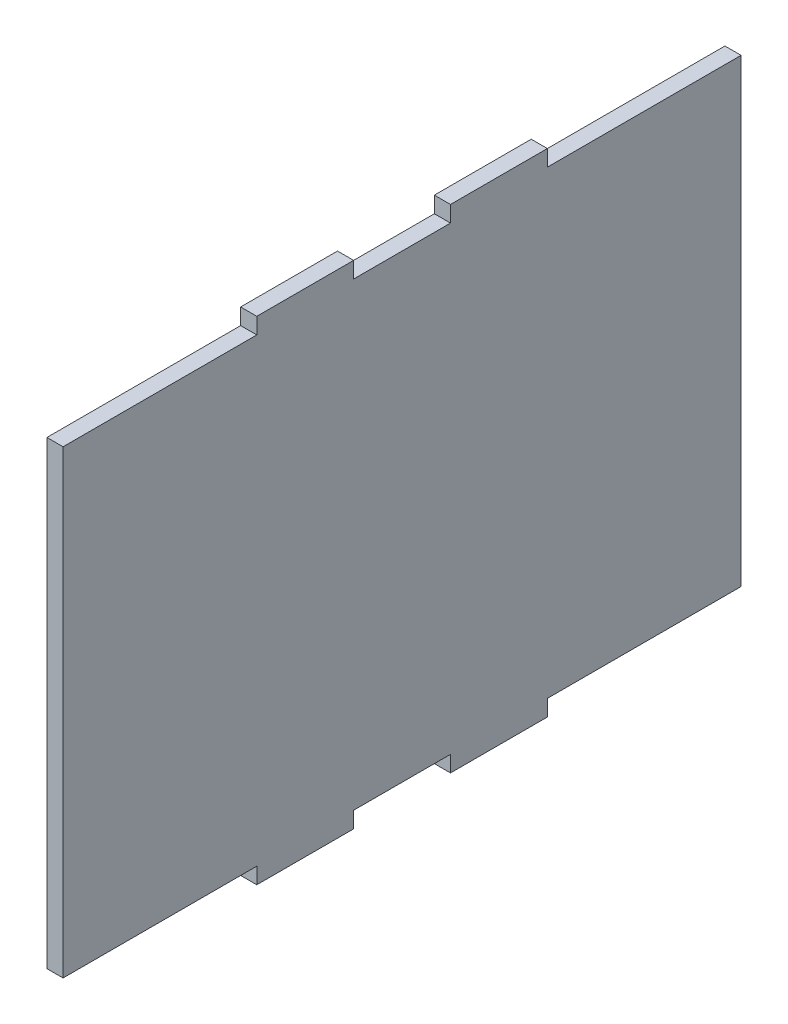
from build123d import *

# Parameters (mm, degrees)
BOSS_EXTRUDE1_DEPTH = 10


with BuildPart() as part:
    # Sketch1 → Boss-Extrude1 (new body)
    with BuildSketch(Plane(origin=(0, 0, 0), x_dir=(0, 0, -1), z_dir=(1, 0, 0))):
        Polygon((-328.894741549, 211.221531582), (-208.894741549, 211.221531582), (-208.894741549, 221.221531582), (-148.894741549, 221.221531582), (-148.894741549, 211.221531582), (-88.894741549, 211.221531582), (-88.894741549, 221.221531582), (-28.894741549, 221.221531582), (-28.894741549, 211.221531582), (91.105258451, 211.221531582), (91.105258451, -73.778468418), (-28.894741549, -73.778468418), (-28.894741549, -83.778468418), (-88.894741549, -83.778468418), (-88.894741549, -73.778468418), (-148.894741549, -73.778468418), (-148.894741549, -83.778468418), (-208.894741549, -83.778468418), (-208.894741549, -73.778468418), (-328.894741549, -73.778468418), align=None)
    extrude(amount=BOSS_EXTRUDE1_DEPTH)


solid = part.part
